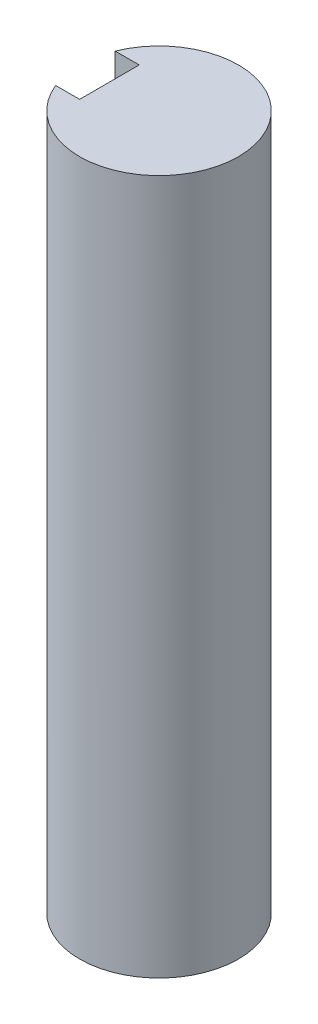
from build123d import *
from build123d.topology import SkipClean

# Parameters (mm, degrees)
SKETCH1_R           = 4
BOSS_EXTRUDE1_DEPTH = 35
CUT_EXTRUDE1_DEPTH  = 22
SKETCH3_R           = 2.5
CUT_EXTRUDE2_DEPTH  = 4
SKETCH4_W           = 3
SKETCH4_H           = 3
CUT_EXTRUDE3_DEPTH  = 5


with BuildPart() as part:
    # Sketch1 → Boss-Extrude1 (new body)
    with BuildSketch(Plane(origin=(0, 0, 0), x_dir=(1, 0, 0), z_dir=(0, 1, 0))):
        with Locations(Location((0, 0, 0), (0, 0, 270))):
            Circle(SKETCH1_R)
    extrude(amount=BOSS_EXTRUDE1_DEPTH)

    # Sketch2 → Cut-Extrude1 (cut)
    with BuildSketch(Plane.XZ):
        with BuildLine():
            Line((-1.5, 2), (1.5, 2))
            ThreePointArc((1.5, 2), (0, -2.5), (-1.5, 2))
        make_face()
    extrude(amount=-CUT_EXTRUDE1_DEPTH, mode=Mode.SUBTRACT)

    # Sketch3 → Cut-Extrude2 (cut)
    with SkipClean():  # the faces are left unmerged after this step: merging them gives an invalid solid
        with BuildSketch(Plane.XZ):
            with Locations(Location((0, 0, 0), (0, 0, 270))):
                Circle(SKETCH3_R)
        extrude(amount=-CUT_EXTRUDE2_DEPTH, mode=Mode.SUBTRACT)

    # Sketch4 → Cut-Extrude3 (cut)
    with SkipClean():  # the faces are left unmerged after this step: merging them gives an invalid solid
        with BuildSketch(Plane(origin=(0, 35, 0), x_dir=(1, 0, 0), z_dir=(0, 1, 0))):
            with Locations((-4, 0)):
                Rectangle(SKETCH4_W, SKETCH4_H)
        extrude(amount=-CUT_EXTRUDE3_DEPTH, mode=Mode.SUBTRACT)


solid = part.part
